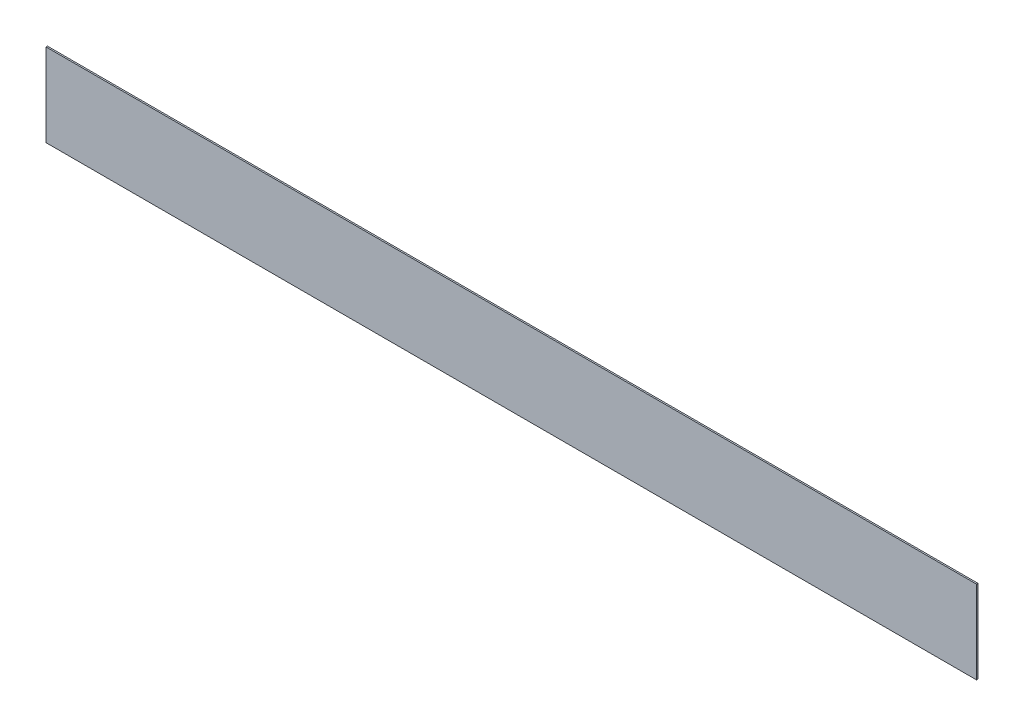
from build123d import *

# Parameters (mm, degrees)
SKETCH1_W           = 813
SKETCH1_H           = 72.46
BOSS_EXTRUDE1_DEPTH = 1.27


with BuildPart() as part:
    # Sketch1 → Boss-Extrude1 (new body)
    with BuildSketch(Plane.XY):
        with Locations((406.5, 36.23)):
            Rectangle(SKETCH1_W, SKETCH1_H)
    extrude(amount=BOSS_EXTRUDE1_DEPTH)


solid = part.part
